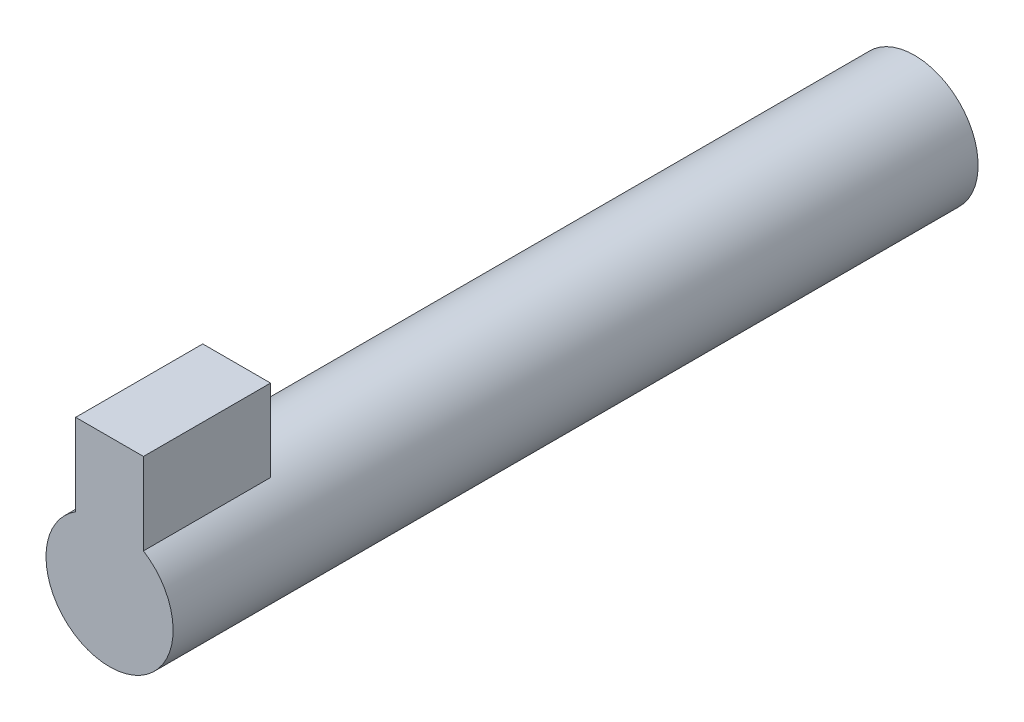
from build123d import *
from build123d.topology import SkipClean

# Parameters (mm, degrees)
BOSS_EXTRUDE1_DEPTH = 9.525
BOSS_EXTRUDE2_START = 50.8
SKETCH2_R           = 4.7625
BOSS_EXTRUDE2_DEPTH = 50.8


with BuildPart() as part:
    # Sketch1 → Boss-Extrude1 (new body)
    with BuildSketch(Plane.XY):
        with BuildLine():
            Line((-2.54, 4.028623369), (-2.54, 0))
            Line((-2.54, 0), (2.54, 0))
            Line((2.54, 0), (2.54, 4.028623369))
            ThreePointArc((2.54, 4.028623369), (0, 4.7625), (-2.54, 4.028623369))
        make_face()
        with BuildLine():
            Line((2.54, 0), (-2.54, 0))
            Line((-2.54, 0), (-2.54, 4.028623369))
            ThreePointArc((-2.54, 4.028623369), (-2.300506058, -4.170021358), (4.7625, 0))
            ThreePointArc((4.7625, 0), (4.170021358, 2.300506058), (2.54, 4.028623369))
            Line((2.54, 4.028623369), (2.54, 0))
        make_face()
        with BuildLine():
            Line((-2.54, 10.16), (-2.54, 4.028623369))
            ThreePointArc((-2.54, 4.028623369), (0, 4.7625), (2.54, 4.028623369))
            Line((2.54, 4.028623369), (2.54, 10.16))
            Line((2.54, 10.16), (-2.54, 10.16))
        make_face()
    extrude(amount=BOSS_EXTRUDE1_DEPTH)

    # Sketch2 → Boss-Extrude2 (add)
    with SkipClean():  # the faces are left unmerged after this step: merging them gives an invalid solid
        with BuildSketch(Plane(origin=(0, 0, 0), x_dir=(-1, 0, 0), z_dir=(0, 0, -1)).offset(BOSS_EXTRUDE2_START)):
            Circle(SKETCH2_R)
        extrude(amount=-BOSS_EXTRUDE2_DEPTH)


solid = part.part
